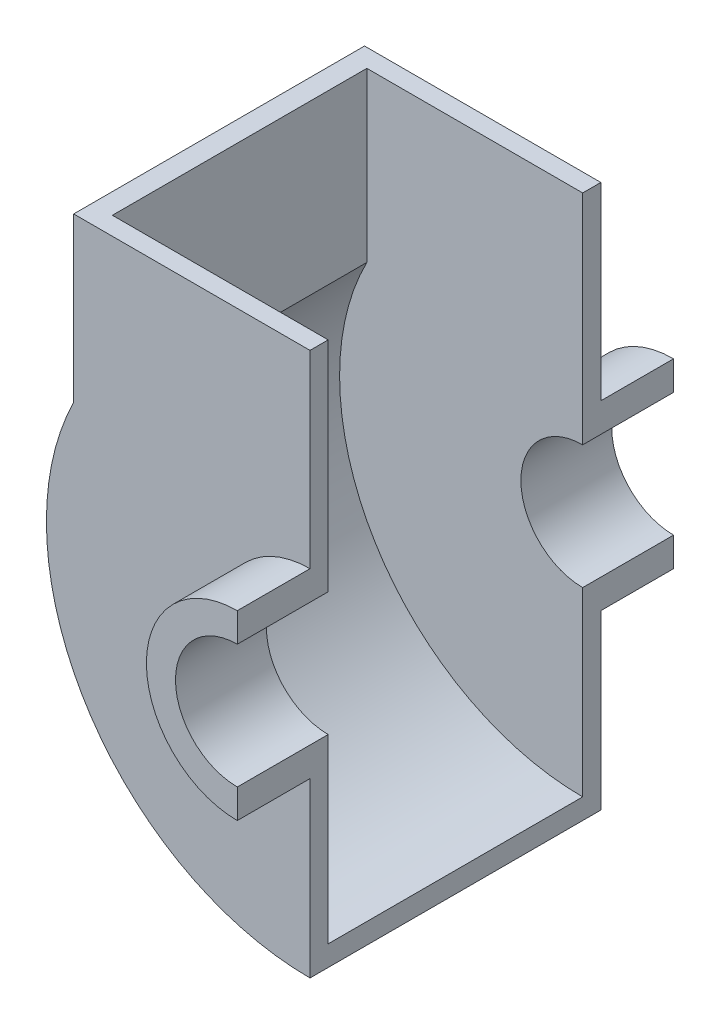
from build123d import *

# Parameters (mm, degrees)
BOSS_EXTRUDE1_DEPTH      = 20
BOSS_EXTRUDE1_DEPTH_BACK = 5
BOSS_EXTRUDE2_START      = -5
BOSS_EXTRUDE2_DEPTH      = 5
BOSS_EXTRUDE3_REACH      = 152.552
BOSS_EXTRUDE3_START      = -5


with BuildPart() as part:
    # Sketch1 → Boss-Extrude1 (new, two sides: drawn at the far end of the back side and taken through both)
    with BuildSketch(Plane.XY.offset(-BOSS_EXTRUDE1_DEPTH_BACK)):
        with BuildLine():
            Line((0, 25), (0, 17))
            ThreePointArc((0, 17), (-17, 0), (0, -17))
            Line((0, -17), (0, -25))
            ThreePointArc((0, -25), (-25, 0), (0, 25))
        make_face()
    extrude(amount=BOSS_EXTRUDE1_DEPTH + BOSS_EXTRUDE1_DEPTH_BACK)

    # Sketch2 → Boss-Extrude2 (add)
    with BuildSketch(Plane.XY.offset(BOSS_EXTRUDE2_START)):
        with BuildLine():
            Line((0, 25), (0, 77))
            Line((0, 77), (-65, 77))
            Line((-65, 77), (-65, 32.113081447))
            ThreePointArc((-65, 32.113081447), (-61.581037686, -38.262590053), (0, -72.5))
            Line((0, -72.5), (0, -25))
            ThreePointArc((0, -25), (-25, 0), (0, 25))
        make_face()
    extrude(amount=BOSS_EXTRUDE2_DEPTH)


with BuildPart() as body_2:
    # Mirror4: mirrored copy
    add(part.part.mirror(Plane.XY.offset(-40)))


with BuildPart() as part_1:
    add(part.part)

    # Sketch3 → Boss-Extrude3 (add, up to next)
    with BuildSketch(Plane(origin=(0, 0, -80), x_dir=(-1, 0, 0), z_dir=(0, 0, -1)).offset(BOSS_EXTRUDE3_START), mode=Mode.PRIVATE) as boss_extrude3_sk1:
        with BuildLine():
            Line((65, 77), (65, 32.113081447))
            ThreePointArc((65, 32.113081447), (61.581037686, -38.262590053), (0, -72.5))
            Line((0, -72.5), (0, -66.86))
            ThreePointArc((0, -66.86), (57.128742944, -34.735663656), (59.36, 30.767677845))
            Line((59.36, 30.767677845), (59.36, 77))
            Line((59.36, 77), (65, 77))
        make_face()
    boss_extrude3_tool1 = extrude(boss_extrude3_sk1.sketch, amount=-BOSS_EXTRUDE3_REACH, mode=Mode.PRIVATE) - part_1.part

    add(body_2.part)  # Boss-Extrude3 merges body 2
    add(boss_extrude3_tool1.solids().sort_by_distance((-61.02152, 53.883839, -75))[0])


solid = part_1.part
